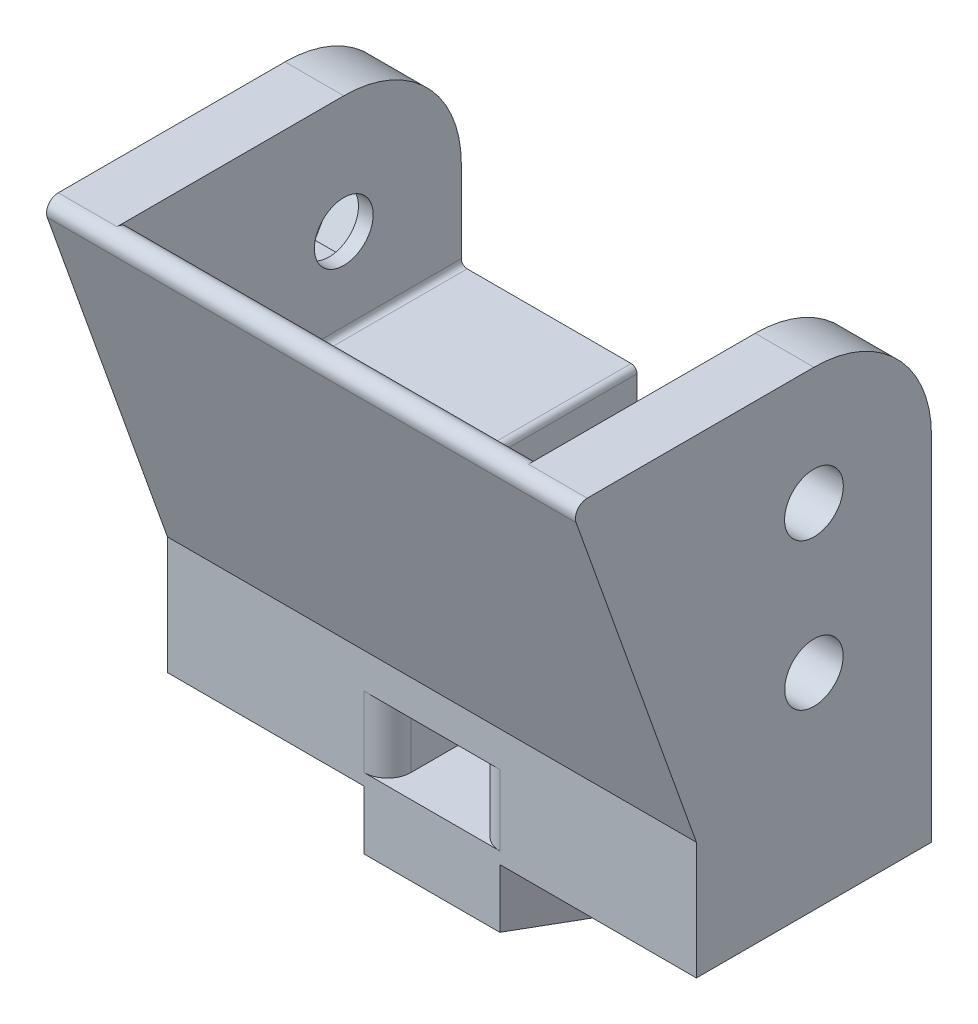
from build123d import *

# Parameters (mm, degrees)
SKETCH2_R                        = 3.15595
SKETCH2_R_2                      = 12.7
SKETCH2_R_3                      = 3.175
BOSS_EXTRUDE1_DEPTH              = 57.15
SKETCH3_W                        = 44.45
SKETCH3_H                        = 12.7
HOLLOWING_DEPTH                  = 25.4
FILLET2_R                        = 0.635
GEAR_CREVASE_DEPTH               = 6.477
SKETCH4_W                        = 57.15
SKETCH4_H                        = 25.4
BASE_EXTENSION_DEPTH             = 12.7
CAPTIVE_NUT_BORE_DEPTH           = 4.7625
HEX_CONNECTION_DEPTH             = 6.35
GEAR_CLEARANCE_DEPTH             = 6.477
BOSS_EXTRUDE6_DEPTH              = 6.35
BOSS_EXTRUDE7_START              = 50.8
BOSS_EXTRUDE7_DEPTH              = 6.35
SKETCH9_W                        = 9.6012
SKETCH9_H                        = 7.62
CUT_EXTRUDE5_DEPTH               = 11.43
CUT_EXTRUDE6_START               = -7.62
CUT_EXTRUDE6_DEPTH               = 7.62
F_10_0_1935_DIAMETER_HOLE1_D     = 5.0419
F_10_0_1935_DIAMETER_HOLE1_DEPTH = 7.62
FILLET3_R                        = 2.54
SKETCH14_R                       = 4.66725
CUT_EXTRUDE7_DEPTH               = 3.175


with BuildPart() as part:
    # Sketch2 → Boss-Extrude1 (new body)
    # profile 1 of 3: a face of its own
    with BuildSketch(Plane(origin=(0, 0, 0), x_dir=(0, 0, -1), z_dir=(1, 0, 0))):
        with BuildLine():
            Line((-12.994989453, 36.403030323), (0, 0))
            Line((0, 0), (0, 24.485346))
            Line((0, 24.485346), (-10.818105201, 37.636792682))
            ThreePointArc((-10.818105201, 37.636792682), (-11.256570169, 37.978374222), (-11.798913831, 38.1))
            ThreePointArc((-11.798913831, 38.1), (-12.83697729, 37.561658565), (-12.994989453, 36.403030323))
        make_face()
    # profile 2 of 3: a face of its own
    with BuildSketch(Plane(origin=(0, 0, 0), x_dir=(0, 0, -1), z_dir=(1, 0, 0))):
        with BuildLine():
            Line((0, 24.485346), (0, 0))
            Line((0, 0), (25.4, 0))
            Line((25.4, 0), (25.4, 25.4))
            ThreePointArc((25.4, 25.4), (12.7, 12.7), (0, 25.4))
            Line((0, 25.4), (0, 24.485346))
        make_face()
        with Locations((12.7, 9.525)):
            Circle(SKETCH2_R, mode=Mode.SUBTRACT)
    # profile 3 of 3: a face of its own
    with BuildSketch(Plane(origin=(0, 0, 0), x_dir=(0, 0, -1), z_dir=(1, 0, 0))):
        with Locations((12.7, 25.4)):
            Circle(SKETCH2_R_2)
        with Locations((12.7, 25.4)):
            Circle(SKETCH2_R_3, mode=Mode.SUBTRACT)
    extrude(amount=BOSS_EXTRUDE1_DEPTH)

    # Sketch3 → Hollowing (cut)
    with BuildSketch(Plane(origin=(0, 0, -25.4), x_dir=(-1, 0, 0), z_dir=(0, 0, -1))):
        Polygon((-50.8, 25.4), (-50.8, 15.875), (-31.8135, 15.875), (-31.8135, 0), (-25.3365, 0), (-25.3365, 15.875), (-6.35, 15.875), (-6.35, 25.4), align=None)
        with Locations((-28.575, 31.75)):
            Rectangle(SKETCH3_W, SKETCH3_H)
    extrude(amount=-HOLLOWING_DEPTH, mode=Mode.SUBTRACT)

    # Fillet2
    fillet2_edges = [part.edges().sort_by_distance(p)[0] for p in [
        (50.8, 15.875, -12.7),
        (25.3365, 15.875, -12.7),
        (31.8135, 15.875, -12.7),
        (6.35, 15.875, -12.7),
    ]]
    fillet(fillet2_edges, radius=FILLET2_R)

    # Sketch8 → Gear Crevase (add)
    with BuildSketch(Plane(origin=(25.3365, 0, 0), x_dir=(0, 0, -1), z_dir=(1, 0, 0))):
        with BuildLine():
            ThreePointArc((4.299739587, 0), (1.124739582, 4.299739599), (0, 9.525000025))
            Line((0, 9.525000025), (0, 0))
            Line((0, 0), (4.299739587, 0))
        make_face()
    extrude(amount=GEAR_CREVASE_DEPTH)

    # Sketch4 → Base Extension (add)
    with BuildSketch(Plane.XZ):
        with Locations((28.575, -12.7)):
            Rectangle(SKETCH4_W, SKETCH4_H)
    extrude(amount=BASE_EXTENSION_DEPTH)

    # Sketch7 → Captive Nut Bore (cut)
    with BuildSketch(Plane.ZY):
        Polygon((-9.470100522, 19.80565), (-6.240201043, 25.4), (-9.470100522, 30.99435), (-15.929899478, 30.99435), (-19.159798957, 25.4), (-15.929899478, 19.80565), align=None)
    extrude(amount=-CAPTIVE_NUT_BORE_DEPTH, mode=Mode.SUBTRACT)

    # Sketch5 → Hex Connection (add)
    with BuildSketch(Plane.XZ.offset(12.7)):
        Polygon((35.907348419, 0), (21.242651581, 0), (13.910303163, -12.7), (21.242651581, -25.4), (35.907348419, -25.4), (43.239696837, -12.7), align=None)
    extrude(amount=HEX_CONNECTION_DEPTH)

    # Sketch8<3> → Gear Clearance (cut)
    with BuildSketch(Plane(origin=(25.3365, 0, 0), x_dir=(0, 0, -1), z_dir=(1, 0, 0))):
        with BuildLine():
            Line((21.100260413, 0), (4.299739587, 0))
            ThreePointArc((4.299739587, 0), (12.7, -3.175), (21.100260413, 0))
        make_face()
    extrude(amount=GEAR_CLEARANCE_DEPTH, mode=Mode.SUBTRACT)

    # Sketch2<3> → Boss-Extrude6 (add)
    with BuildSketch(Plane(origin=(0, 0, 0), x_dir=(0, 0, -1), z_dir=(1, 0, 0))):
        with BuildLine():
            Line((-10.818105201, 37.636792682), (0, 24.485346))
            Line((0, 24.485346), (0, 25.4))
            ThreePointArc((0, 25.4), (3.719743879, 34.380256121), (12.7, 38.1))
            Line((12.7, 38.1), (-11.798913831, 38.1))
            ThreePointArc((-11.798913831, 38.1), (-11.256570169, 37.978374222), (-10.818105201, 37.636792682))
        make_face()
    extrude(amount=BOSS_EXTRUDE6_DEPTH)

    # Sketch2<4> → Boss-Extrude7 (add)
    with BuildSketch(Plane(origin=(0, 0, 0), x_dir=(0, 0, -1), z_dir=(1, 0, 0)).offset(BOSS_EXTRUDE7_START)):
        with BuildLine():
            Line((-10.818105201, 37.636792682), (0, 24.485346))
            Line((0, 24.485346), (0, 25.4))
            ThreePointArc((0, 25.4), (3.719743879, 34.380256121), (12.7, 38.1))
            Line((12.7, 38.1), (-11.798913831, 38.1))
            ThreePointArc((-11.798913831, 38.1), (-11.256570169, 37.978374222), (-10.818105201, 37.636792682))
        make_face()
    extrude(amount=BOSS_EXTRUDE7_DEPTH)

    # Sketch9 → Cut-Extrude5 (cut)
    with BuildSketch(Plane.XY):
        with Locations((28.575, -7.62)):
            Rectangle(SKETCH9_W, SKETCH9_H)
    extrude(amount=-CUT_EXTRUDE5_DEPTH, mode=Mode.SUBTRACT)

    # Sketch10 → Cut-Extrude6 (cut)
    with BuildSketch(Plane.XZ.offset(19.05).offset(CUT_EXTRUDE6_START)):
        Polygon((28.575, -7.156744595), (23.7744, -9.928372298), (23.7744, -15.471627702), (28.575, -18.243255405), (33.3756, -15.471627702), (33.3756, -9.928372298), align=None)
    extrude(amount=-CUT_EXTRUDE6_DEPTH, mode=Mode.SUBTRACT)

    # #10 (0.1935) Diameter Hole1
    with Locations(Plane(origin=(0, -19.05, 0), x_dir=(-1, 0, 0), z_dir=(0, -1, 0))):
        with Locations((-28.575, 12.7)):
            Hole(F_10_0_1935_DIAMETER_HOLE1_D / 2, depth=F_10_0_1935_DIAMETER_HOLE1_DEPTH)

    # Fillet3
    fillet3_edges = [part.edges().sort_by_distance(p)[0] for p in [
        (33.3756, -7.62, 0),
        (23.7744, -7.62, 0),
    ]]
    fillet(fillet3_edges, radius=FILLET3_R)

    # Sketch14 → Cut-Extrude7 (cut)
    with BuildSketch(Plane.ZY):
        with Locations((-12.7, 9.525)):
            Circle(SKETCH14_R)
    extrude(amount=-CUT_EXTRUDE7_DEPTH, mode=Mode.SUBTRACT)


solid = part.part
